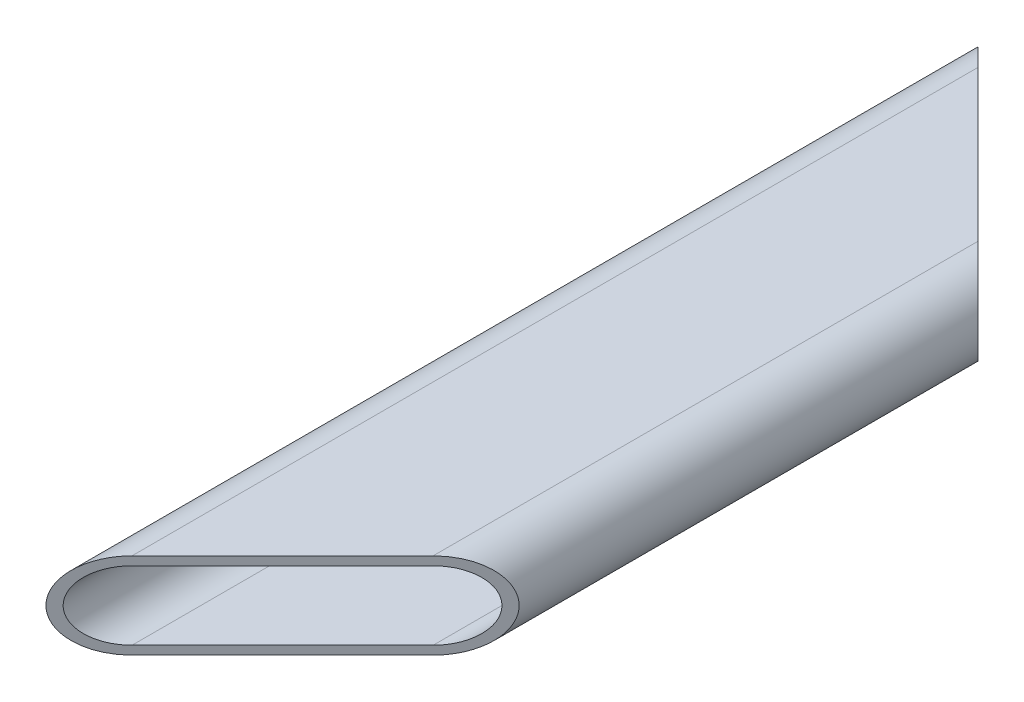
from build123d import *

# Parameters (mm, degrees)
BOSS_EXTRUDE1_DEPTH = 130
CUT_EXTRUDE1_DEPTH  = 30


with BuildPart() as part:
    # Sketch1 → Boss-Extrude1 (new body)
    with BuildSketch(Plane.XY):
        with BuildLine():
            Line((0, 6), (21, 6))
            ThreePointArc((21, 6), (27, 0), (21, -6))
            Line((21, -6), (0, -6))
            ThreePointArc((0, -6), (-6, 0), (0, 6))
        make_face()
        with BuildLine():
            Line((0, 4.8), (21, 4.8))
            ThreePointArc((21, 4.8), (25.8, 0), (21, -4.8))
            Line((21, -4.8), (0, -4.8))
            ThreePointArc((0, -4.8), (-4.8, 0), (0, 4.8))
        make_face(mode=Mode.SUBTRACT)
    extrude(amount=BOSS_EXTRUDE1_DEPTH)

    # Sketch2 → Cut-Extrude1 (cut)
    with BuildSketch(Plane(origin=(0, 6, 0), x_dir=(1, 0, 0), z_dir=(0, 1, 0))):
        Polygon((-6, 0), (27, -33), (27, 0), align=None)
        Polygon((-6, -130), (27, -97), (27, -130), align=None)
    extrude(amount=-CUT_EXTRUDE1_DEPTH, mode=Mode.SUBTRACT)


solid = part.part
